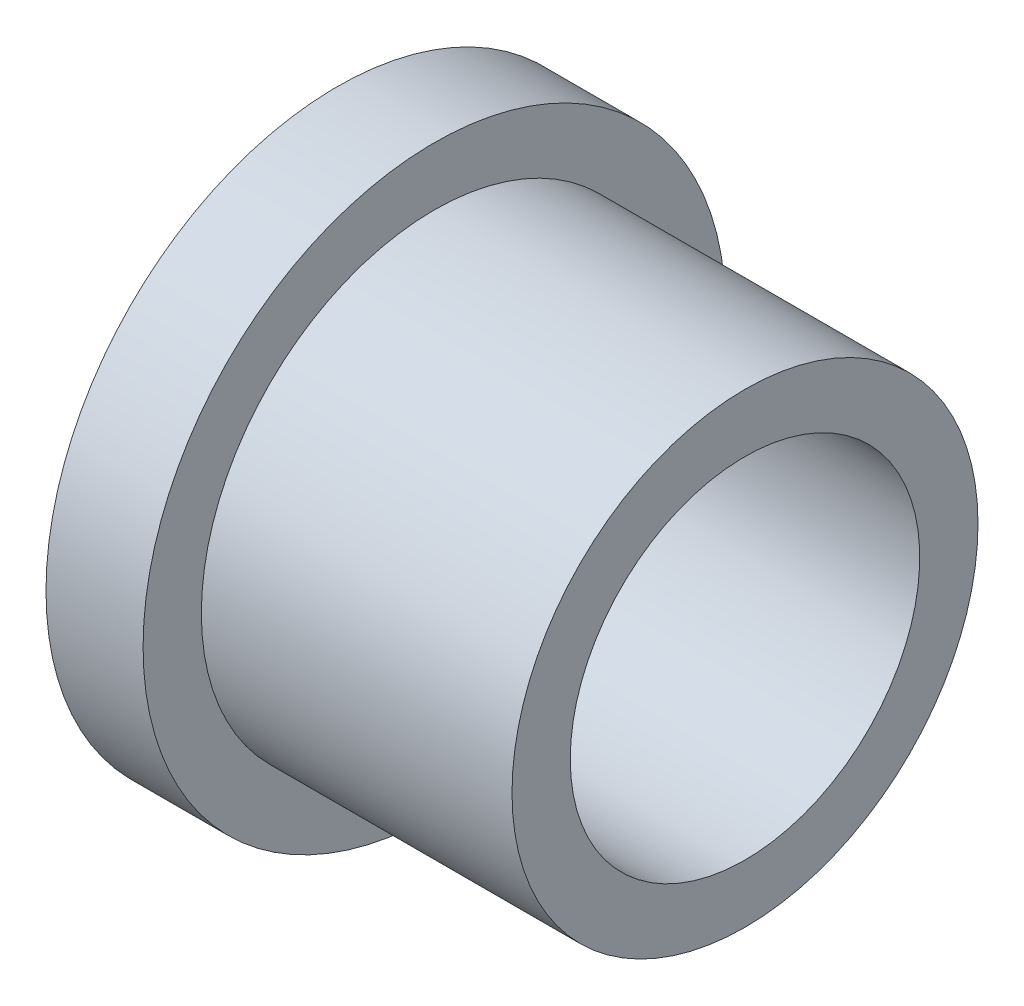
from build123d import *


with BuildPart() as part:
    # Sketch1 → Revolve1 (revolve)
    with BuildSketch(Plane.XY, mode=Mode.PRIVATE) as revolve1_sk:
        Polygon((0, 9), (0, 15), (5, 15), (5, 12), (21, 12), (21, 9), align=None)
    revolve(revolve1_sk.sketch.rotate(Axis((0, 0, 0), (1, 0, 0)), 90), axis=Axis((0, 0, 0), (1, 0, 0)))


solid = part.part
